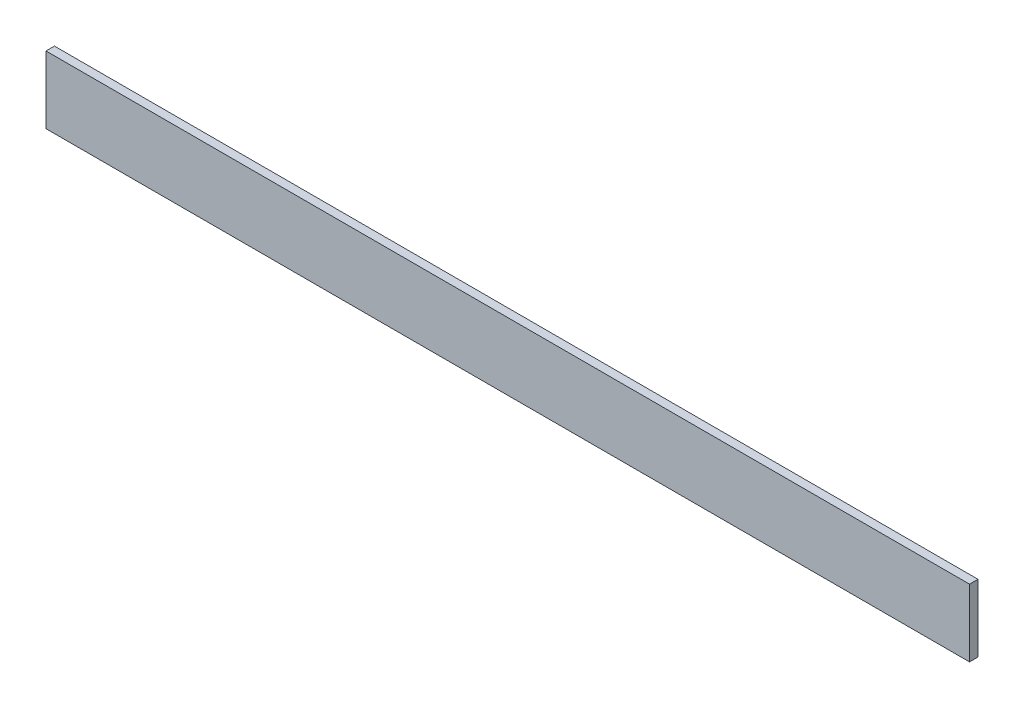
from build123d import *

# Parameters (mm, degrees)
SKETCH1_W           = 609.6
SKETCH1_H           = 44.45
BOSS_EXTRUDE1_DEPTH = 5.588


with BuildPart() as part:
    # Sketch1 → Boss-Extrude1 (new body)
    with BuildSketch(Plane.XY):
        with Locations((222.25, 3.175)):
            Rectangle(SKETCH1_W, SKETCH1_H)
    extrude(amount=BOSS_EXTRUDE1_DEPTH)


solid = part.part
